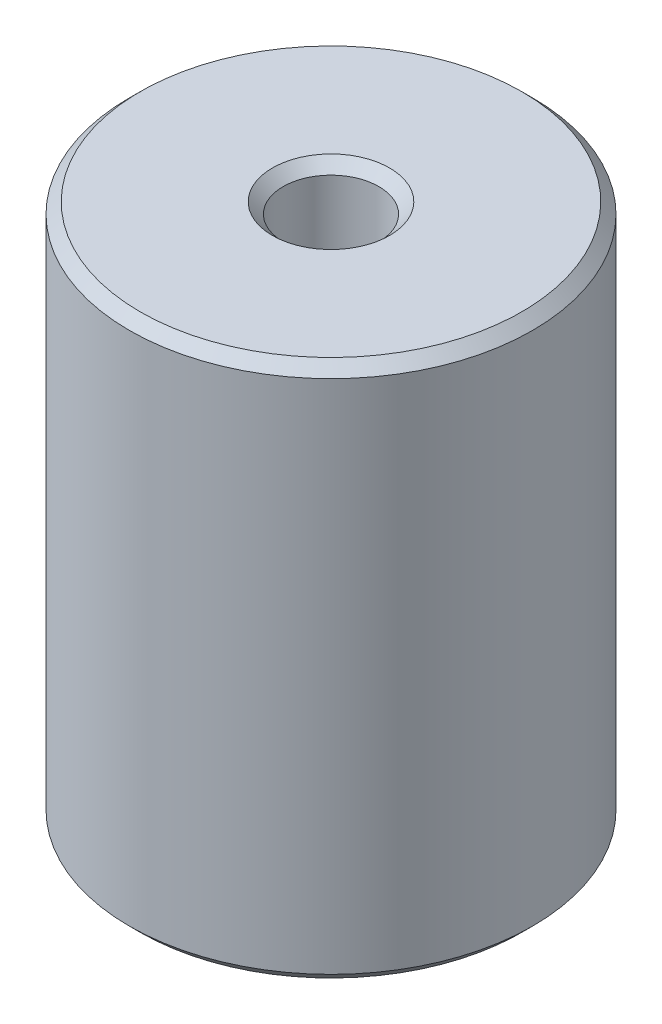
from build123d import *

# Parameters (mm, degrees)
SKETCH1_R           = 4.7625
SKETCH1_R_2         = 1.1303
BOSS_EXTRUDE1_DEPTH = 12.7
CHAMFER1_SIZE       = 0.254


with BuildPart() as part:
    # Sketch1 → Boss-Extrude1 (new body)
    with BuildSketch(Plane(origin=(0, 0, 0), x_dir=(1, 0, 0), z_dir=(0, 1, 0))):
        with Locations(Location((0, 0, 0), (0, 0, 270))):
            Circle(SKETCH1_R)
        with Locations(Location((0, 0, 0), (0, 0, 270))):
            Circle(SKETCH1_R_2, mode=Mode.SUBTRACT)
    extrude(amount=BOSS_EXTRUDE1_DEPTH)

    # Chamfer1
    chamfer1_edges = [part.edges().sort_by_distance(p)[0] for p in [
        (0, 0, -4.7625),
        (0, 12.7, -4.7625),
        (0, 0, -1.1303),
        (0, 12.7, -1.1303),
    ]]
    chamfer(chamfer1_edges, length=CHAMFER1_SIZE)


solid = part.part
